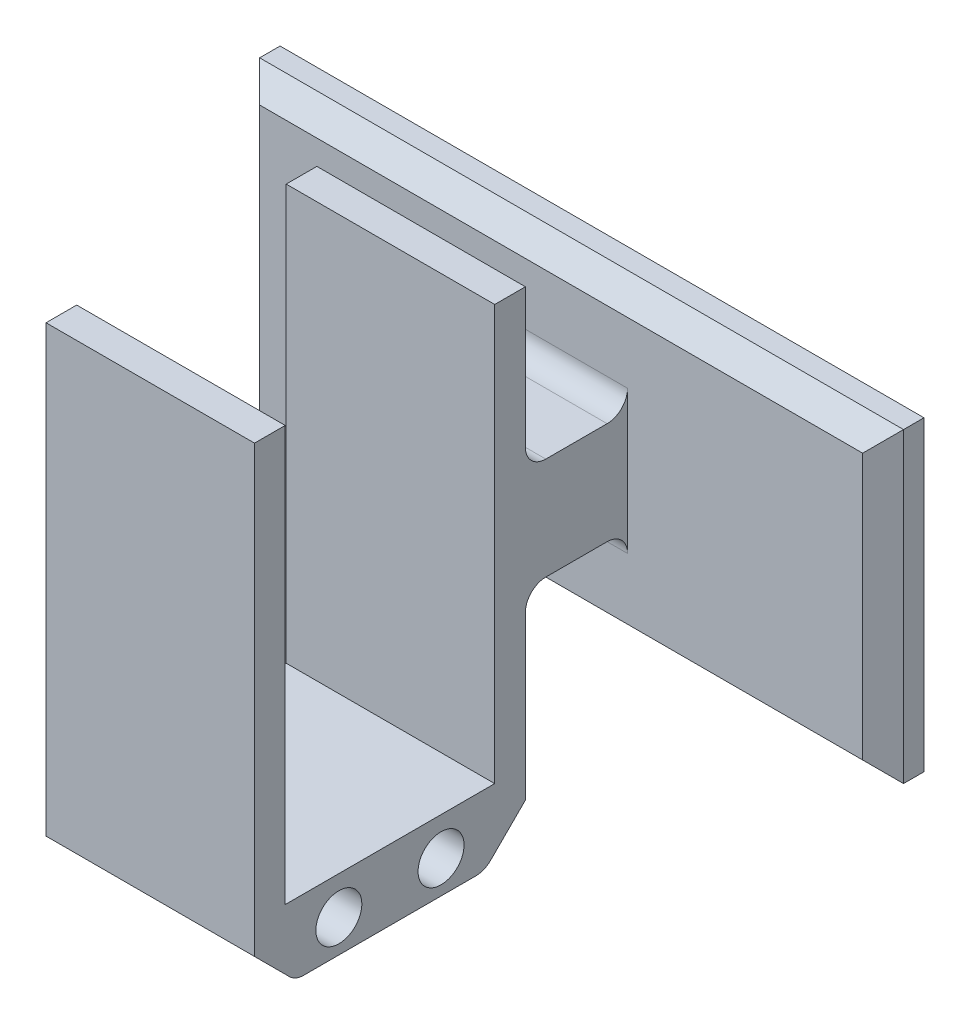
from build123d import *

# Parameters (mm, degrees)
SKETCH1_R            = 2.25
BOSS_EXTRUDE1_DEPTH  = 20
SKETCH2_R            = 2.25
BOSS_EXTRUDE2_DEPTH  = 10
SKETCH4_W            = 26.5
SKETCH4_H            = 2.5
CUT_EXTRUDE1_DEPTH   = 39.17921555
CHAMFER2_SIZE        = 4
CHAMFER3_SIZE        = 4
FILLET4_R            = 2
SKETCH7_W            = 10
SKETCH7_H            = 10
BOSS_EXTRUDE5_DEPTH  = 20
FILLET6_R            = 2
SKETCH8_W            = 63
SKETCH8_H            = 30
BOSS_EXTRUDE6_DEPTH  = 4
CHAMFER4_SIZE        = 2
FILLET7_R            = 2
SKETCH13_R           = 2.25
BOSS_EXTRUDE8_DEPTH  = 20
CUT_EXTRUDE2_DEPTH   = 54.816005983
BOSS_EXTRUDE9_START  = -10
SKETCH14_R           = 2.25
BOSS_EXTRUDE9_DEPTH  = 10
SKETCH15_R           = 2.25
BOSS_EXTRUDE10_DEPTH = 0.4


with BuildPart() as part:
    # Sketch1 → Boss-Extrude1 (new body)
    with BuildSketch(Plane(origin=(0, 0, 0), x_dir=(0, 0, -1), z_dir=(1, 0, 0))):
        Polygon((10.25, -20.3), (13.25, -20.3), (13.25, 29.7), (-13.25, 29.7), (-13.25, -20.3), (-10.25, -20.3), (-10.25, 20.3), (10.25, 20.3), align=None)
        with Locations((5, 24)):
            Circle(SKETCH1_R, mode=Mode.SUBTRACT)
        with Locations((-5, 24)):
            Circle(SKETCH1_R, mode=Mode.SUBTRACT)
    extrude(amount=BOSS_EXTRUDE1_DEPTH)

    # Sketch2 → Boss-Extrude2 (add)
    with BuildSketch(Plane.ZY):
        with Locations((-5, 24)):
            Circle(SKETCH2_R)
        with Locations((5, 24)):
            Circle(SKETCH2_R)
    extrude(amount=-BOSS_EXTRUDE2_DEPTH)

    # Sketch4 → Cut-Extrude1 (cut, through all)
    with BuildSketch(Plane(origin=(20, 0, 0), x_dir=(0, 0, -1), z_dir=(1, 0, 0))):
        with Locations((0, 28.45)):
            Rectangle(SKETCH4_W, SKETCH4_H)
    extrude(amount=-CUT_EXTRUDE1_DEPTH, mode=Mode.SUBTRACT)

    # Chamfer2
    chamfer2_edges = [part.edges().sort_by_distance(p)[0] for p in [
        (10, 27.2, -13.25),
    ]]
    chamfer(chamfer2_edges, length=CHAMFER2_SIZE)

    # Chamfer3
    chamfer3_edges = [part.edges().sort_by_distance(p)[0] for p in [
        (10, 27.2, 13.25),
    ]]
    chamfer(chamfer3_edges, length=CHAMFER3_SIZE)

    # Fillet4
    fillet4_edges = [part.edges().sort_by_distance(p)[0] for p in [
        (10, 27.2, -9.25),
        (10, 27.2, 9.25),
    ]]
    fillet(fillet4_edges, radius=FILLET4_R)

    # Sketch7 → Boss-Extrude5 (add)
    with BuildSketch(Plane(origin=(20, 0, 0), x_dir=(0, 0, -1), z_dir=(1, 0, 0))):
        with Locations((18.25, -0.3)):
            Rectangle(SKETCH7_W, SKETCH7_H)
    extrude(amount=-BOSS_EXTRUDE5_DEPTH)

    # Fillet6
    fillet6_edges = [part.edges().sort_by_distance(p)[0] for p in [
        (10, -5.3, -13.25),
        (10, 4.7, -13.25),
    ]]
    fillet(fillet6_edges, radius=FILLET6_R)

    # Sketch8 → Boss-Extrude6 (add)
    with BuildSketch(Plane(origin=(0, 0, -23.25), x_dir=(-1, 0, 0), z_dir=(0, 0, -1))):
        with Locations((-13.9, -0.3)):
            Rectangle(SKETCH8_W, SKETCH8_H)
    extrude(amount=BOSS_EXTRUDE6_DEPTH)

    # Chamfer4
    chamfer4_edges = [part.edges().sort_by_distance(p)[0] for p in [
        (45.4, -0.3, -23.25),
        (13.9, -15.3, -23.25),
        (-17.6, -0.3, -23.25),
        (13.9, 14.7, -23.25),
    ]]
    chamfer(chamfer4_edges, length=CHAMFER4_SIZE)

    # Fillet7
    fillet7_edges = [part.edges().sort_by_distance(p)[0] for p in [
        (10, 4.7, -23.25),
        (10, -5.3, -23.25),
    ]]
    fillet(fillet7_edges, radius=FILLET7_R)

    # Sketch13 → Boss-Extrude8 (add)
    with BuildSketch(Plane(origin=(20, 0, 0), x_dir=(0, 0, -1), z_dir=(1, 0, 0))):
        with BuildLine():
            Line((-13.25, -23.2), (-9.835786438, -26.614213562))
            ThreePointArc((-9.835786438, -26.614213562), (-9.18693974, -27.047759065), (-8.421572875, -27.2))
            Line((-8.421572875, -27.2), (8.421572875, -27.2))
            ThreePointArc((8.421572875, -27.2), (9.18693974, -27.047759065), (9.835786438, -26.614213562))
            Line((9.835786438, -26.614213562), (13.25, -23.2))
            Line((13.25, -23.2), (13.25, -20.3))
            Line((13.25, -20.3), (-13.25, -20.3))
            Line((-13.25, -20.3), (-13.25, -23.2))
        make_face()
        with Locations((5, -24)):
            Circle(SKETCH13_R, mode=Mode.SUBTRACT)
        with Locations((-5, -24)):
            Circle(SKETCH13_R, mode=Mode.SUBTRACT)
    extrude(amount=-BOSS_EXTRUDE8_DEPTH)

    # Sketch12 → Cut-Extrude2 (cut, through all)
    with BuildSketch(Plane(origin=(20, 0, 0), x_dir=(0, 0, -1), z_dir=(1, 0, 0))):
        with BuildLine():
            Line((13.25, 23.2), (9.835786438, 26.614213562))
            ThreePointArc((9.835786438, 26.614213562), (9.18693974, 27.047759065), (8.421572875, 27.2))
            Line((8.421572875, 27.2), (-8.421572875, 27.2))
            ThreePointArc((-8.421572875, 27.2), (-9.18693974, 27.047759065), (-9.835786438, 26.614213562))
            Line((-9.835786438, 26.614213562), (-13.25, 23.2))
            Line((-13.25, 23.2), (-13.25, 20.3))
            Line((-13.25, 20.3), (13.25, 20.3))
            Line((13.25, 20.3), (13.25, 23.2))
        make_face()
    extrude(amount=-CUT_EXTRUDE2_DEPTH, mode=Mode.SUBTRACT)

    # Sketch14 → Boss-Extrude9 (add)
    with BuildSketch(Plane.ZY.offset(BOSS_EXTRUDE9_START)):
        with Locations(Location((-5, -24, 0), (0, 0, 180))):
            Circle(SKETCH14_R)
        with Locations(Location((5, -24, 0), (0, 0, 180))):
            Circle(SKETCH14_R)
    extrude(amount=BOSS_EXTRUDE9_DEPTH)

    # Sketch15 → Boss-Extrude10 (add)
    with BuildSketch(Plane(origin=(20, 0, 0), x_dir=(0, 0, -1), z_dir=(1, 0, 0))):
        with BuildLine():
            Line((-10.25, 20.3), (-13.25, 20.3))
            Line((-13.25, 20.3), (-13.25, -23.2))
            Line((-13.25, -23.2), (-9.835786438, -26.614213562))
            ThreePointArc((-9.835786438, -26.614213562), (-9.18693974, -27.047759065), (-8.421572875, -27.2))
            Line((-8.421572875, -27.2), (8.421572875, -27.2))
            ThreePointArc((8.421572875, -27.2), (9.18693974, -27.047759065), (9.835786438, -26.614213562))
            Line((9.835786438, -26.614213562), (13.25, -23.2))
            Line((13.25, -23.2), (13.25, -7.3))
            ThreePointArc((13.25, -7.3), (13.835786438, -5.885786438), (15.25, -5.3))
            Line((15.25, -5.3), (21.25, -5.3))
            ThreePointArc((21.25, -5.3), (22.664213562, -5.885786438), (23.25, -7.3))
            Line((23.25, -7.3), (23.25, 6.7))
            ThreePointArc((23.25, 6.7), (22.664213562, 5.285786438), (21.25, 4.7))
            Line((21.25, 4.7), (15.25, 4.7))
            ThreePointArc((15.25, 4.7), (13.835786438, 5.285786438), (13.25, 6.7))
            Line((13.25, 6.7), (13.25, 20.3))
            Line((13.25, 20.3), (10.25, 20.3))
            Line((10.25, 20.3), (10.25, -20.3))
            Line((10.25, -20.3), (-10.25, -20.3))
            Line((-10.25, -20.3), (-10.25, 20.3))
        make_face()
        with Locations((5, -24)):
            Circle(SKETCH15_R, mode=Mode.SUBTRACT)
        with Locations((-5, -24)):
            Circle(SKETCH15_R, mode=Mode.SUBTRACT)
    extrude(amount=BOSS_EXTRUDE10_DEPTH)


solid = part.part
